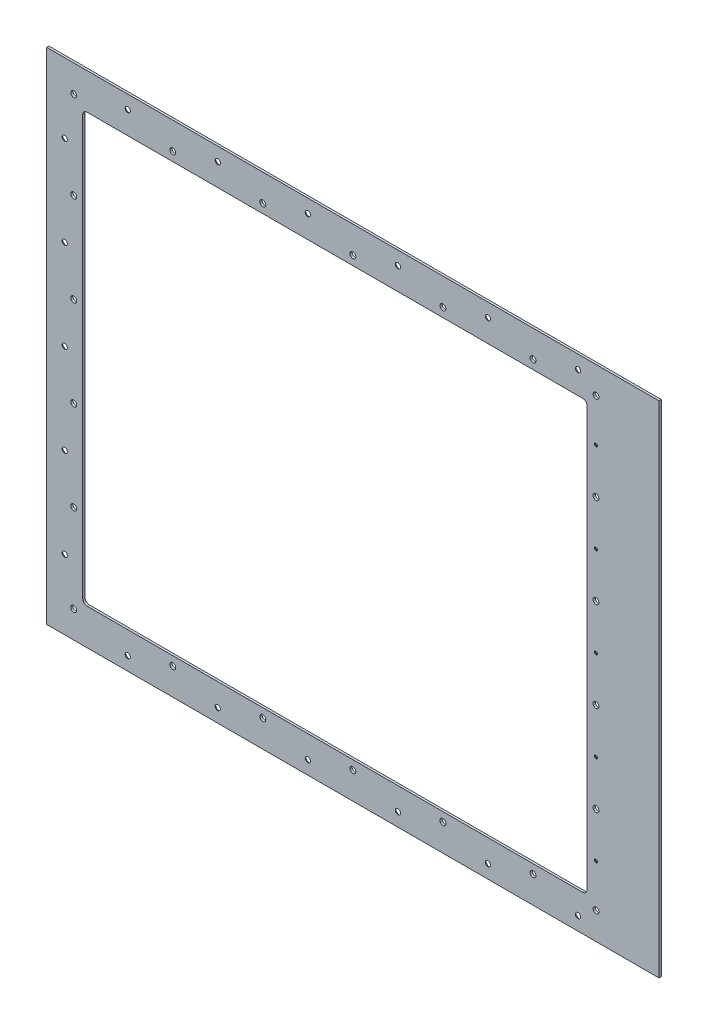
from build123d import *

# Parameters (mm, degrees)
SKETCH1_W                        = 863.6
SKETCH1_H                        = 704.85
BOSS_EXTRUDE1_DEPTH              = 3.175
SKETCH2_W                        = 711.2
SKETCH2_H                        = 603.25
CUT_EXTRUDE1_DEPTH               = 1115.732507432
LPATTERN4_COUNT                  = 6
LPATTERN4_PITCH                  = 127
LPATTERN4_COUNT_DIR2             = 2
LPATTERN4_PITCH_DIR2             = 666.75
LPATTERN5_COUNT                  = 5
LPATTERN5_PITCH                  = 127
F_21_64_0_32813_DIAMETER_HOLE1_D = 8.334502
LPATTERN6_COUNT                  = 2
LPATTERN6_PITCH                  = 736.6
LPATTERN6_COUNT_DIR2             = 2
LPATTERN6_PITCH_DIR2             = 628.65
F_21_64_0_32813_DIAMETER_HOLE2_D = 8.334502
LPATTERN7_COUNT                  = 5
LPATTERN7_PITCH                  = 127
LPATTERN7_COUNT_DIR2             = 2
LPATTERN7_PITCH_DIR2             = 628.65
F_21_64_0_32813_DIAMETER_HOLE3_D = 8.334502
LPATTERN8_COUNT                  = 4
LPATTERN8_PITCH                  = 127
LPATTERN8_COUNT_DIR2             = 2
LPATTERN8_PITCH_DIR2             = 736.6
FILLET1_R                        = 6.35
LPATTERN9_COUNT                  = 5
LPATTERN9_PITCH                  = 127


with BuildPart() as part:
    # Sketch1 → Boss-Extrude1 (new body)
    with BuildSketch(Plane.XY):
        with Locations((431.8, 352.425)):
            Rectangle(SKETCH1_W, SKETCH1_H)
    extrude(amount=BOSS_EXTRUDE1_DEPTH)

    # Sketch2 → Cut-Extrude1 (cut, through all)
    with BuildSketch(Plane.XY.offset(3.175)):
        with Locations((406.4, 352.425)):
            Rectangle(SKETCH2_W, SKETCH2_H)
    extrude(amount=-CUT_EXTRUDE1_DEPTH, mode=Mode.SUBTRACT)

    # Sketch12 → CSK for 1/4 Flat Head Machine Screw2 (revolve, cut)
    with BuildSketch(Plane(origin=(114.3, 19.05, 0), x_dir=(0, 1, 0), z_dir=(1, 0, 0))):
        Polygon((0, 0), (0, 3.175), (3.3782, 3.175), (3.3782, 3.520932584), (6.4389, 0), align=None)
    csk_for_1_4_flat_head_machine_screw2 = revolve(axis=Axis((114.3, 19.05, -6.35), (0, 0, 1)), mode=Mode.SUBTRACT)

    # LPattern4: CSK for 1_4 Flat Head Machine Screw2 6 × 2
    with Locations(*[(i * LPATTERN4_PITCH, j * LPATTERN4_PITCH_DIR2, 0) for i in range(LPATTERN4_COUNT) for j in range(LPATTERN4_COUNT_DIR2) if (i, j) != (0, 0)]):
        add(csk_for_1_4_flat_head_machine_screw2, mode=Mode.SUBTRACT)

    # Sketch14 → CSK for 1/4 Flat Head Machine Screw3 (revolve, cut)
    with BuildSketch(Plane(origin=(25.4, 98.425, 0), x_dir=(0, 1, 0), z_dir=(1, 0, 0))):
        Polygon((0, 0), (0, 3.175), (3.3782, 3.175), (3.3782, 3.520932584), (6.4389, 0), align=None)
    csk_for_1_4_flat_head_machine_screw3 = revolve(axis=Axis((25.4, 98.425, -6.35), (0, 0, 1)), mode=Mode.SUBTRACT)

    # LPattern5: CSK for 1/4 Flat Head Machine Screw3 ×5
    with Locations(*[(0, i * LPATTERN5_PITCH, 0) for i in range(1, LPATTERN5_COUNT)]):
        add(csk_for_1_4_flat_head_machine_screw3, mode=Mode.SUBTRACT)

    # 21/64 (0.32813) Diameter Hole1 (through all)
    with Locations(Plane(origin=(0, 0, 0), x_dir=(-1, 0, 0), z_dir=(0, 0, -1))):
        with Locations((-38.1, 38.1)):
            f_21_64_0_32813_diameter_hole1 = Hole(F_21_64_0_32813_DIAMETER_HOLE1_D / 2)

    # LPattern6: 21_64 _0.32813_ Diameter Hole1 2 × 2
    with Locations(*[(i * LPATTERN6_PITCH, j * LPATTERN6_PITCH_DIR2, 0) for i in range(LPATTERN6_COUNT) for j in range(LPATTERN6_COUNT_DIR2) if (i, j) != (0, 0)]):
        add(f_21_64_0_32813_diameter_hole1, mode=Mode.SUBTRACT)

    # 21/64 (0.32813) Diameter Hole2 (through all)
    with Locations(Plane(origin=(0, 0, 0), x_dir=(-1, 0, 0), z_dir=(0, 0, -1))):
        with Locations((-177.8, 38.1)):
            f_21_64_0_32813_diameter_hole2 = Hole(F_21_64_0_32813_DIAMETER_HOLE2_D / 2)

    # LPattern7: 21_64 _0.32813_ Diameter Hole2 5 × 2
    with Locations(*[(i * LPATTERN7_PITCH, j * LPATTERN7_PITCH_DIR2, 0) for i in range(LPATTERN7_COUNT) for j in range(LPATTERN7_COUNT_DIR2) if (i, j) != (0, 0)]):
        add(f_21_64_0_32813_diameter_hole2, mode=Mode.SUBTRACT)

    # 21/64 (0.32813) Diameter Hole3 (through all)
    with Locations(Plane(origin=(0, 0, 0), x_dir=(-1, 0, 0), z_dir=(0, 0, -1))):
        with Locations((-38.1, 161.925)):
            f_21_64_0_32813_diameter_hole3 = Hole(F_21_64_0_32813_DIAMETER_HOLE3_D / 2)

    # LPattern8: 21_64 _0.32813_ Diameter Hole3 4 × 2
    with Locations(*[(j * LPATTERN8_PITCH_DIR2, i * LPATTERN8_PITCH, 0) for i in range(LPATTERN8_COUNT) for j in range(LPATTERN8_COUNT_DIR2) if (i, j) != (0, 0)]):
        add(f_21_64_0_32813_diameter_hole3, mode=Mode.SUBTRACT)

    # Fillet1
    fillet1_edges = [part.edges().sort_by_distance(p)[0] for p in [
        (50.8, 50.8, 1.5875),
        (50.8, 654.05, 1.5875),
        (762, 654.05, 1.5875),
        (762, 50.8, 1.5875),
    ]]
    fillet(fillet1_edges, radius=FILLET1_R)

    # Sketch22 → CSK for #8 Flat Head Machine Screw1 (revolve, cut)
    with BuildSketch(Plane(origin=(774.7, 606.425, 0), x_dir=(0, 1, 0), z_dir=(1, 0, 0))):
        Polygon((0, 0), (0, 3.175), (2.2479, 3.175), (2.2479, 2.26450021), (4.2164, 0), align=None)
    csk_for_8_flat_head_machine_screw1 = revolve(axis=Axis((774.7, 606.425, -6.35), (0, 0, 1)), mode=Mode.SUBTRACT)

    # LPattern9: CSK for #8 Flat Head Machine Screw1 ×5
    with Locations(*[(0, -i * LPATTERN9_PITCH, 0) for i in range(1, LPATTERN9_COUNT)]):
        add(csk_for_8_flat_head_machine_screw1, mode=Mode.SUBTRACT)


solid = part.part
